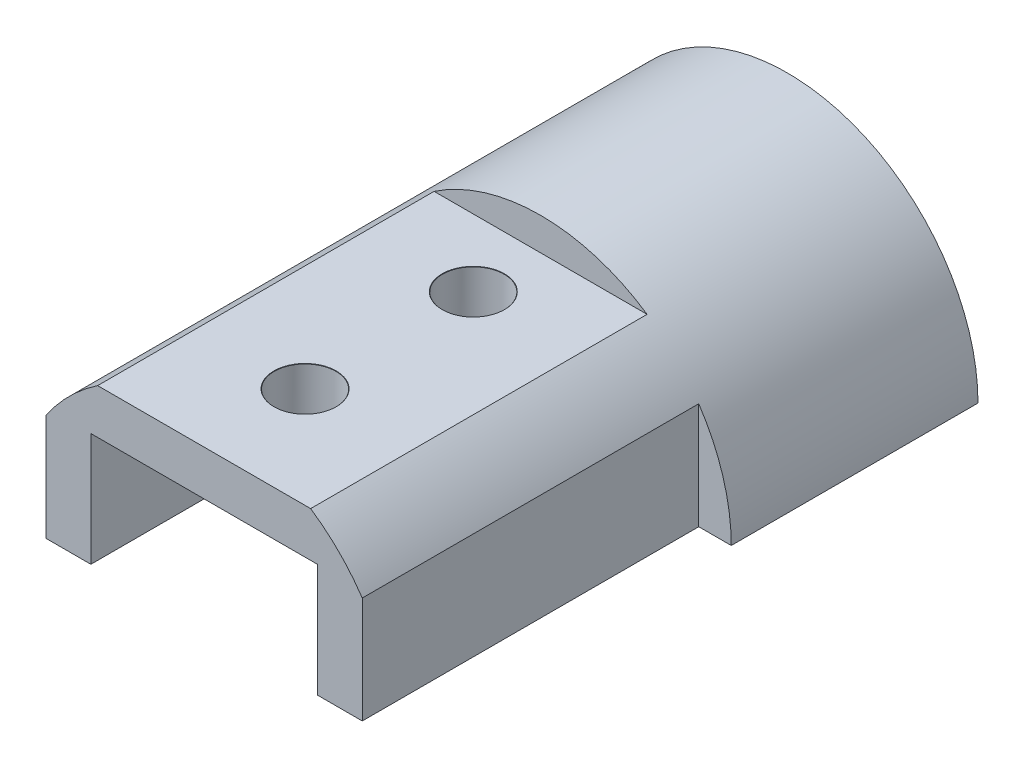
from build123d import *

# Parameters (mm, degrees)
SKETCH_1_R                     = 17
EXTRUDE_1_DEPTH                = 2
SKETCH_2_R                     = 17
SKETCH_2_R_2                   = 15
EXTRUDE_2_DEPTH                = 10
SKETCH_3_R                     = 5
CUT_EXTRUDE_1_DEPTH            = 27.038433133
SKETCH_4_R                     = 17
EXTRUDE_3_DEPTH                = 10
SKETCH_5_W                     = 20.2
SKETCH_5_H                     = 20.2
EXTRUDE_4_DEPTH                = 30
HOLE_WIZARD_M5_2_D             = 5.5
HOLE_WIZARD_M5_2_CSINK_D       = 5.55
HOLE_WIZARD_M5_2_CSINK_ANGLE   = 90
HOLE_WIZARD_M2_5_2_D           = 2.9
HOLE_WIZARD_M2_5_2_CSINK_D     = 2.95
HOLE_WIZARD_M2_5_2_CSINK_ANGLE = 90
SKETCH1_W                      = 65
SKETCH1_H                      = 40
CUT_EXTRUDE2_DEPTH             = 58.28874235


with BuildPart() as part:
    # 草图1 → 凸台-拉伸1 (new body)
    with BuildSketch(Plane.XY):
        Circle(SKETCH_1_R)
    extrude(amount=EXTRUDE_1_DEPTH)

    # 草图2 → 凸台-拉伸2 (add)
    with BuildSketch(Plane.XY.offset(2)):
        Circle(SKETCH_2_R)
        Circle(SKETCH_2_R_2, mode=Mode.SUBTRACT)
    extrude(amount=EXTRUDE_2_DEPTH)

    # 草图3 → 切除-拉伸1 (cut, through all)
    with BuildSketch(Plane.XY.offset(2)):
        Circle(SKETCH_3_R)
    extrude(amount=-CUT_EXTRUDE_1_DEPTH, mode=Mode.SUBTRACT)

    # 草图4 → 凸台-拉伸3 (add)
    with BuildSketch(Plane.XY.offset(12)):
        Circle(SKETCH_4_R)
        Polygon((-4.443145751, 10.1), (4.443145751, 10.1), (10.1, 4.443145751), (10.1, -4.443145751), (4.443145751, -10.1), (-4.443145751, -10.1), (-10.1, -4.443145751), (-10.1, 4.443145751), align=None, mode=Mode.SUBTRACT)
    extrude(amount=EXTRUDE_3_DEPTH)

    # 草图5 → 凸台-拉伸4 (add)
    with BuildSketch(Plane.XY.offset(22)):
        with BuildLine():
            Line((9.49684158, 14.1), (-9.49684158, 14.1))
            ThreePointArc((-9.49684158, 14.1), (-12.02081528, 12.02081528), (-14.1, 9.49684158))
            Line((-14.1, 9.49684158), (-14.1, -9.496842588))
            ThreePointArc((-14.1, -9.496842588), (-12.020815678, -12.020815678), (-9.496842588, -14.1))
            Line((-9.496842588, -14.1), (9.49684158, -14.1))
            ThreePointArc((9.49684158, -14.1), (12.02081528, -12.02081528), (14.1, -9.49684158))
            Line((14.1, -9.49684158), (14.1, 9.49684158))
            ThreePointArc((14.1, 9.49684158), (12.02081528, 12.02081528), (9.49684158, 14.1))
        make_face()
        Rectangle(SKETCH_5_W, SKETCH_5_H, mode=Mode.SUBTRACT)
    extrude(amount=EXTRUDE_4_DEPTH)

    # M5 间隙孔2 (through all)
    with Locations(Plane(origin=(0, 14.1, 0), x_dir=(1, 0, 0), z_dir=(0, 1, 0))):
        with Locations((0, -28), (0, -43)):
            CounterSinkHole(HOLE_WIZARD_M5_2_D / 2, HOLE_WIZARD_M5_2_CSINK_D / 2, counter_sink_angle=HOLE_WIZARD_M5_2_CSINK_ANGLE)

    # M2.5 间隙孔2 (through all)
    with Locations(Plane.XY.offset(2)):
        with Locations((0, 8), (5.656854249, 5.656854249), (8, 0), (5.656854249, -5.656854249), (0, -8), (-5.656854249, -5.656854249), (-8, 0), (-5.656854249, 5.656854249)):
            CounterSinkHole(HOLE_WIZARD_M2_5_2_D / 2, HOLE_WIZARD_M2_5_2_CSINK_D / 2, counter_sink_angle=HOLE_WIZARD_M2_5_2_CSINK_ANGLE)

    # Sketch1 → Cut-Extrude2 (cut, through all)
    with BuildSketch(Plane(origin=(0, 0, 0), x_dir=(0, 0, -1), z_dir=(0, 1, 0))):
        with Locations((-30, 0)):
            Rectangle(SKETCH1_W, SKETCH1_H)
    extrude(amount=-CUT_EXTRUDE2_DEPTH, mode=Mode.SUBTRACT)


solid = part.part
